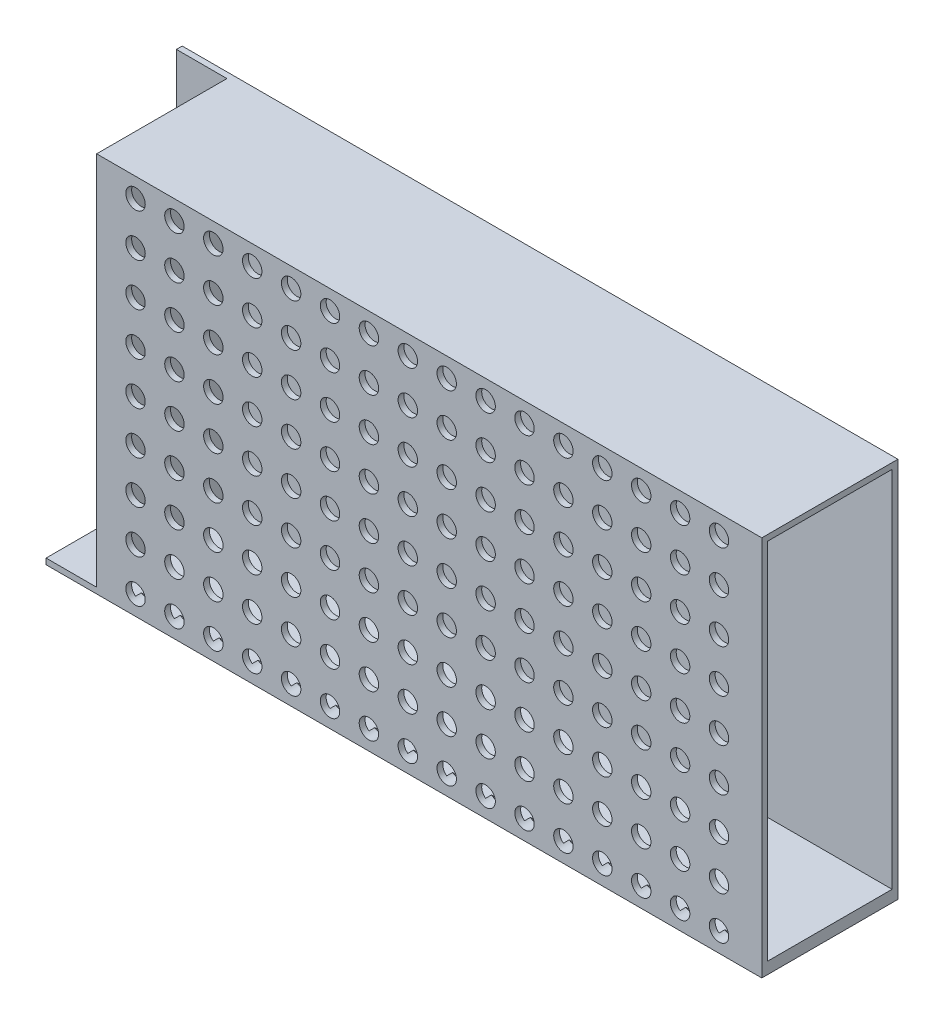
from build123d import *

# Parameters (mm, degrees)
SKETCH1_W           = 184
SKETCH1_H           = 98
BOSS_EXTRUDE1_DEPTH = 35
SKETCH2_W           = 13
SKETCH2_H           = 96.5
CUT_EXTRUDE1_DEPTH  = 33.5
SKETCH3_W           = 32
SKETCH3_H           = 93.5
CUT_EXTRUDE2_DEPTH  = 169.5
SKETCH4_R           = 2.5
CUT_EXTRUDE4_DEPTH  = 3
LPATTERN1_COUNT     = 16
LPATTERN1_PITCH     = 10


with BuildPart() as part:
    # Sketch1 → Boss-Extrude1 (new body)
    with BuildSketch(Plane.XY):
        Rectangle(SKETCH1_W, SKETCH1_H)
    extrude(amount=BOSS_EXTRUDE1_DEPTH)

    # Sketch2 → Cut-Extrude1 (cut)
    with BuildSketch(Plane.XY.offset(35)):
        with Locations((-85.5, 0.75)):
            Rectangle(SKETCH2_W, SKETCH2_H)
    extrude(amount=-CUT_EXTRUDE1_DEPTH, mode=Mode.SUBTRACT)

    # Sketch3 → Cut-Extrude2 (cut)
    with BuildSketch(Plane(origin=(92, 0, 0), x_dir=(0, 0, -1), z_dir=(1, 0, 0))):
        with Locations((-17.5, 0.75)):
            Rectangle(SKETCH3_W, SKETCH3_H)
    extrude(amount=-CUT_EXTRUDE2_DEPTH, mode=Mode.SUBTRACT)

    # Sketch4 → Cut-Extrude4 (cut)
    with BuildSketch(Plane.XY.offset(35)):
        with Locations((-69, 44)):
            Circle(SKETCH4_R)
        with Locations((-69, 33)):
            Circle(SKETCH4_R)
        with Locations((-69, 22)):
            Circle(SKETCH4_R)
        with Locations((-69, 11)):
            Circle(SKETCH4_R)
        with Locations((-69, 0)):
            Circle(SKETCH4_R)
        with Locations((-69, -11)):
            Circle(SKETCH4_R)
        with Locations((-69, -22)):
            Circle(SKETCH4_R)
        with Locations((-69, -33)):
            Circle(SKETCH4_R)
        with Locations((-69, -44)):
            Circle(SKETCH4_R)
    cut_extrude4 = extrude(amount=-CUT_EXTRUDE4_DEPTH, mode=Mode.SUBTRACT)

    # LPattern1: Cut-Extrude4 ×16
    with Locations(*[(i * LPATTERN1_PITCH, 0, 0) for i in range(1, LPATTERN1_COUNT)]):
        add(cut_extrude4, mode=Mode.SUBTRACT)


solid = part.part
